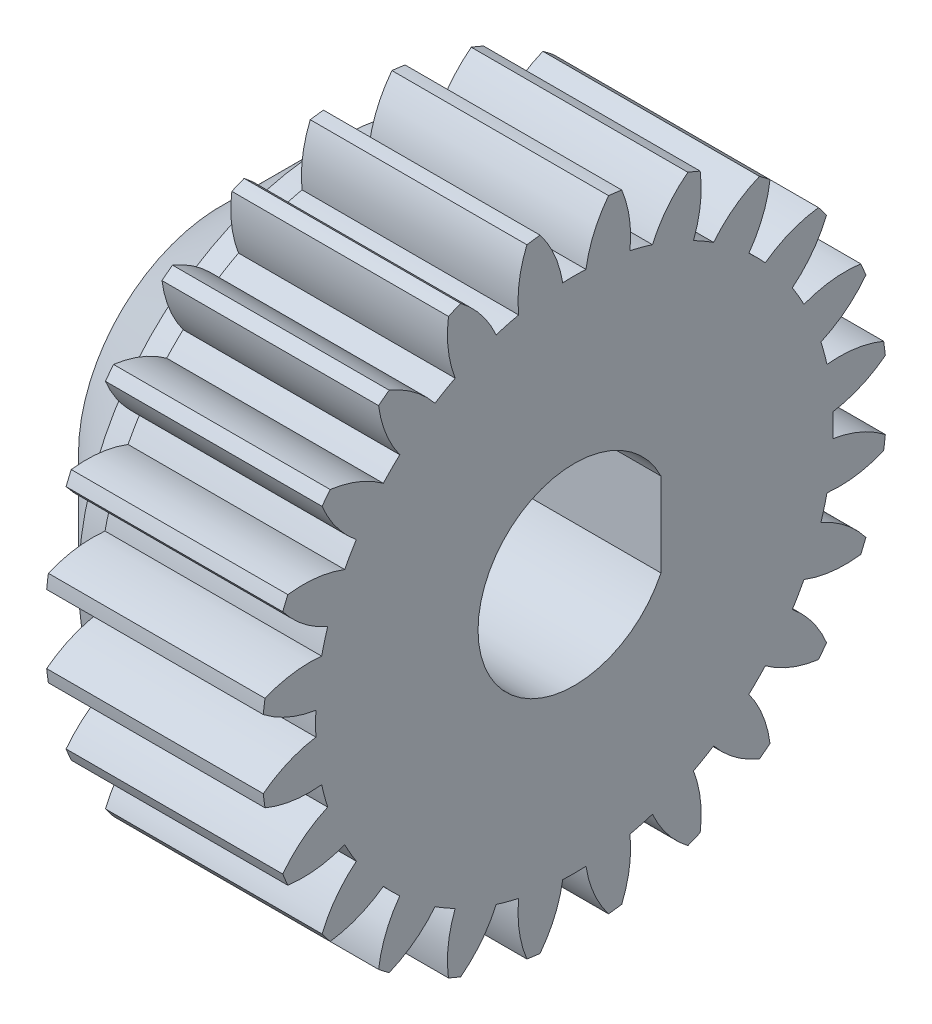
from build123d import *

# Parameters (mm, degrees)
SKETCH_1_W           = 4.5
SKETCH_1_H           = 6.5
CUT_EXTRUDE_1_DEPTH  = 11.234744745
CUT_EXTRUDE_2_DEPTH  = 11.234744745
CUT_EXTRUDE_3_DEPTH  = 11.234744745
CUT_EXTRUDE_4_DEPTH  = 11.234744745
CUT_EXTRUDE_5_DEPTH  = 11.234744745
CUT_EXTRUDE_6_DEPTH  = 11.234744745
CUT_EXTRUDE_7_DEPTH  = 11.234744745
CUT_EXTRUDE_8_DEPTH  = 11.234744745
CUT_EXTRUDE_9_DEPTH  = 11.234744745
CUT_EXTRUDE_10_DEPTH = 11.234744745
CUT_EXTRUDE_11_DEPTH = 11.234744745
CUT_EXTRUDE_12_DEPTH = 11.234744745
CUT_EXTRUDE_13_DEPTH = 11.234744745
CUT_EXTRUDE_14_DEPTH = 11.234744745
CUT_EXTRUDE_15_DEPTH = 11.234744745
CUT_EXTRUDE_16_DEPTH = 11.234744745
CUT_EXTRUDE_17_DEPTH = 11.234744745
CUT_EXTRUDE_18_DEPTH = 11.234744745
CUT_EXTRUDE_19_DEPTH = 11.209995045
CUT_EXTRUDE_20_DEPTH = 11.209995045
CUT_EXTRUDE_21_DEPTH = 11.209995045
CUT_EXTRUDE_22_DEPTH = 11.209995045
CUT_EXTRUDE_23_DEPTH = 11.209995045
CUT_EXTRUDE_24_DEPTH = 11.209995045
SKETCH_28_R          = 5.3
EXTRUDE_2_DEPTH      = 0.5
SKETCH_26_R          = 5.3
EXTRUDE_1_DEPTH      = 2.33
EXTRUDE_1_TAPER      = 45
CUT_EXTRUDE_25_DEPTH = 12.713961717


with BuildPart() as part:
    # 草图1 → 旋转1 (revolve)
    with BuildSketch(Plane(origin=(0, 0, 0), x_dir=(-1, 0, 0), z_dir=(0, 0, -1)), mode=Mode.PRIVATE) as revolve_1_sk:
        with Locations((-2.25, 3.25)):
            Rectangle(SKETCH_1_W, SKETCH_1_H)
    revolve(revolve_1_sk.sketch.rotate(Axis((4.5, 0, 0), (-1, 0, 0)), 270), axis=Axis((4.5, 0, 0), (-1, 0, 0)))

    # 草图2 → 切除-拉伸1 (cut, through all)
    with BuildSketch(Plane(origin=(4.5, 0, 0), x_dir=(0, 0, -1), z_dir=(1, 0, 0))):
        with BuildLine():
            ThreePointArc((-6.056700011, 2.359318752), (-6.278517871, 1.682323793), (-6.424915449, 0.98512003))
            ThreePointArc((-6.424915449, 0.98512003), (-5.84730165, 1.144628565), (-5.248177569, 1.156074481))
            ThreePointArc((-5.248177569, 1.156074481), (-5.19088539, 1.390893548), (-5.123092339, 1.622898915))
            ThreePointArc((-5.123092339, 1.622898915), (-5.636226055, 1.93237341), (-6.056700011, 2.359318752))
        make_face()
    extrude(amount=-CUT_EXTRUDE_1_DEPTH, mode=Mode.SUBTRACT)

    # 草图3 → 切除-拉伸2 (cut, through all)
    with BuildSketch(Plane(origin=(4.5, 0, 0), x_dir=(0, 0, -1), z_dir=(1, 0, 0))):
        with BuildLine():
            ThreePointArc((-5.239686336, 3.846516229), (-5.629165125, 3.25), (-5.951023938, 2.614443361))
            ThreePointArc((-5.951023938, 2.614443361), (-5.351808006, 2.619019322), (-4.770136161, 2.475010506))
            ThreePointArc((-4.770136161, 2.475010506), (-4.65402052, 2.687), (-4.528490053, 2.893553842))
            ThreePointArc((-4.528490053, 2.893553842), (-4.944041268, 3.325292028), (-5.239686336, 3.846516229))
        make_face()
    extrude(amount=-CUT_EXTRUDE_2_DEPTH, mode=Mode.SUBTRACT)

    # 草图4 → 切除-拉伸3 (cut, through all)
    with BuildSketch(Plane(origin=(4.5, 0, 0), x_dir=(0, 0, -1), z_dir=(1, 0, 0))):
        with BuildLine():
            ThreePointArc((-4.065596697, 5.071579981), (-4.596194078, 4.596194078), (-5.071579981, 4.065596697))
            ThreePointArc((-5.071579981, 4.065596697), (-4.49159749, 3.91492824), (-3.967017857, 3.625278654))
            ThreePointArc((-3.967017857, 3.625278654), (-3.799991842, 3.799991842), (-3.625278654, 3.967017857))
            ThreePointArc((-3.625278654, 3.967017857), (-3.91492824, 4.49159749), (-4.065596697, 5.071579981))
        make_face()
    extrude(amount=-CUT_EXTRUDE_3_DEPTH, mode=Mode.SUBTRACT)

    # 草图5 → 切除-拉伸4 (cut, through all)
    with BuildSketch(Plane(origin=(4.5, 0, 0), x_dir=(0, 0, -1), z_dir=(1, 0, 0))):
        with BuildLine():
            ThreePointArc((-3.846516229, 5.239686336), (-3.325292028, 4.944041268), (-2.893553842, 4.528490053))
            ThreePointArc((-2.893553842, 4.528490053), (-2.687, 4.65402052), (-2.475010506, 4.770136161))
            ThreePointArc((-2.475010506, 4.770136161), (-2.619019322, 5.351808006), (-2.614443361, 5.951023938))
            ThreePointArc((-2.614443361, 5.951023938), (-3.25, 5.629165125), (-3.846516229, 5.239686336))
        make_face()
    extrude(amount=-CUT_EXTRUDE_4_DEPTH, mode=Mode.SUBTRACT)

    # 草图6 → 切除-拉伸5 (cut, through all)
    with BuildSketch(Plane(origin=(4.5, 0, 0), x_dir=(0, 0, -1), z_dir=(1, 0, 0))):
        with BuildLine():
            ThreePointArc((-2.359318752, 6.056700011), (-1.93237341, 5.636226055), (-1.622898915, 5.123092339))
            ThreePointArc((-1.622898915, 5.123092339), (-1.390893548, 5.19088539), (-1.156074481, 5.248177569))
            ThreePointArc((-1.156074481, 5.248177569), (-1.144628565, 5.84730165), (-0.98512003, 6.424915449))
            ThreePointArc((-0.98512003, 6.424915449), (-1.682323793, 6.278517871), (-2.359318752, 6.056700011))
        make_face()
    extrude(amount=-CUT_EXTRUDE_5_DEPTH, mode=Mode.SUBTRACT)

    # 草图7 → 切除-拉伸6 (cut, through all)
    with BuildSketch(Plane(origin=(4.5, 0, 0), x_dir=(0, 0, -1), z_dir=(1, 0, 0))):
        with BuildLine():
            ThreePointArc((0.711337602, 6.460959589), (0, 6.5), (-0.711337602, 6.460959589))
            ThreePointArc((-0.711337602, 6.460959589), (-0.407766737, 5.94431135), (-0.241646108, 5.368564348))
            ThreePointArc((-0.241646108, 5.368564348), (0, 5.374), (0.241646108, 5.368564348))
            ThreePointArc((0.241646108, 5.368564348), (0.407766737, 5.94431135), (0.711337602, 6.460959589))
        make_face()
    extrude(amount=-CUT_EXTRUDE_6_DEPTH, mode=Mode.SUBTRACT)

    # 草图8 → 切除-拉伸7 (cut, through all)
    with BuildSketch(Plane(origin=(4.5, 0, 0), x_dir=(0, 0, -1), z_dir=(1, 0, 0))):
        with BuildLine():
            ThreePointArc((2.359318752, 6.056700011), (1.682323793, 6.278517871), (0.98512003, 6.424915449))
            ThreePointArc((0.98512003, 6.424915449), (1.144628565, 5.84730165), (1.156074481, 5.248177569))
            ThreePointArc((1.156074481, 5.248177569), (1.390893548, 5.19088539), (1.622898915, 5.123092339))
            ThreePointArc((1.622898915, 5.123092339), (1.93237341, 5.636226055), (2.359318752, 6.056700011))
        make_face()
    extrude(amount=-CUT_EXTRUDE_7_DEPTH, mode=Mode.SUBTRACT)

    # 草图9 → 切除-拉伸8 (cut, through all)
    with BuildSketch(Plane(origin=(4.5, 0, 0), x_dir=(0, 0, -1), z_dir=(1, 0, 0))):
        with BuildLine():
            ThreePointArc((3.846516229, 5.239686336), (3.25, 5.629165125), (2.614443361, 5.951023938))
            ThreePointArc((2.614443361, 5.951023938), (2.619019322, 5.351808006), (2.475010506, 4.770136161))
            ThreePointArc((2.475010506, 4.770136161), (2.687, 4.65402052), (2.893553842, 4.528490053))
            ThreePointArc((2.893553842, 4.528490053), (3.325292028, 4.944041268), (3.846516229, 5.239686336))
        make_face()
    extrude(amount=-CUT_EXTRUDE_8_DEPTH, mode=Mode.SUBTRACT)

    # 草图10 → 切除-拉伸9 (cut, through all)
    with BuildSketch(Plane(origin=(4.5, 0, 0), x_dir=(0, 0, -1), z_dir=(1, 0, 0))):
        with BuildLine():
            ThreePointArc((5.071579981, 4.065596697), (4.596194078, 4.596194078), (4.065596697, 5.071579981))
            ThreePointArc((4.065596697, 5.071579981), (3.91492824, 4.49159749), (3.625278654, 3.967017857))
            ThreePointArc((3.625278654, 3.967017857), (3.799991842, 3.799991842), (3.967017857, 3.625278654))
            ThreePointArc((3.967017857, 3.625278654), (4.49159749, 3.91492824), (5.071579981, 4.065596697))
        make_face()
    extrude(amount=-CUT_EXTRUDE_9_DEPTH, mode=Mode.SUBTRACT)

    # 草图11 → 切除-拉伸10 (cut, through all)
    with BuildSketch(Plane(origin=(4.5, 0, 0), x_dir=(0, 0, -1), z_dir=(1, 0, 0))):
        with BuildLine():
            ThreePointArc((5.951023938, 2.614443361), (5.629165125, 3.25), (5.239686336, 3.846516229))
            ThreePointArc((5.239686336, 3.846516229), (4.944041268, 3.325292028), (4.528490053, 2.893553842))
            ThreePointArc((4.528490053, 2.893553842), (4.65402052, 2.687), (4.770136161, 2.475010506))
            ThreePointArc((4.770136161, 2.475010506), (5.351808006, 2.619019322), (5.951023938, 2.614443361))
        make_face()
    extrude(amount=-CUT_EXTRUDE_10_DEPTH, mode=Mode.SUBTRACT)

    # 草图12 → 切除-拉伸11 (cut, through all)
    with BuildSketch(Plane(origin=(4.5, 0, 0), x_dir=(0, 0, -1), z_dir=(1, 0, 0))):
        with BuildLine():
            ThreePointArc((6.424915449, 0.98512003), (6.278517871, 1.682323793), (6.056700011, 2.359318752))
            ThreePointArc((6.056700011, 2.359318752), (5.636226055, 1.93237341), (5.123092339, 1.622898915))
            ThreePointArc((5.123092339, 1.622898915), (5.19088539, 1.390893548), (5.248177569, 1.156074481))
            ThreePointArc((5.248177569, 1.156074481), (5.84730165, 1.144628565), (6.424915449, 0.98512003))
        make_face()
    extrude(amount=-CUT_EXTRUDE_11_DEPTH, mode=Mode.SUBTRACT)

    # 草图13 → 切除-拉伸12 (cut, through all)
    with BuildSketch(Plane(origin=(4.5, 0, 0), x_dir=(0, 0, -1), z_dir=(1, 0, 0))):
        with BuildLine():
            ThreePointArc((6.460959589, -0.711337602), (6.5, 0), (6.460959589, 0.711337602))
            ThreePointArc((6.460959589, 0.711337602), (5.94431135, 0.407766737), (5.368564348, 0.241646108))
            ThreePointArc((5.368564348, 0.241646108), (5.374, 0), (5.368564348, -0.241646108))
            ThreePointArc((5.368564348, -0.241646108), (5.94431135, -0.407766737), (6.460959589, -0.711337602))
        make_face()
    extrude(amount=-CUT_EXTRUDE_12_DEPTH, mode=Mode.SUBTRACT)

    # 草图14 → 切除-拉伸13 (cut, through all)
    with BuildSketch(Plane(origin=(4.5, 0, 0), x_dir=(0, 0, -1), z_dir=(1, 0, 0))):
        with BuildLine():
            ThreePointArc((6.056700011, -2.359318752), (6.278517871, -1.682323793), (6.424915449, -0.98512003))
            ThreePointArc((6.424915449, -0.98512003), (5.84730165, -1.144628565), (5.248177569, -1.156074481))
            ThreePointArc((5.248177569, -1.156074481), (5.19088539, -1.390893548), (5.123092339, -1.622898915))
            ThreePointArc((5.123092339, -1.622898915), (5.636226055, -1.93237341), (6.056700011, -2.359318752))
        make_face()
    extrude(amount=-CUT_EXTRUDE_13_DEPTH, mode=Mode.SUBTRACT)

    # 草图15 → 切除-拉伸14 (cut, through all)
    with BuildSketch(Plane(origin=(4.5, 0, 0), x_dir=(0, 0, -1), z_dir=(1, 0, 0))):
        with BuildLine():
            ThreePointArc((5.239686336, -3.846516229), (5.629165125, -3.25), (5.951023938, -2.614443361))
            ThreePointArc((5.951023938, -2.614443361), (5.351808006, -2.619019322), (4.770136161, -2.475010506))
            ThreePointArc((4.770136161, -2.475010506), (4.65402052, -2.687), (4.528490053, -2.893553842))
            ThreePointArc((4.528490053, -2.893553842), (4.944041268, -3.325292028), (5.239686336, -3.846516229))
        make_face()
    extrude(amount=-CUT_EXTRUDE_14_DEPTH, mode=Mode.SUBTRACT)

    # 草图16 → 切除-拉伸15 (cut, through all)
    with BuildSketch(Plane(origin=(4.5, 0, 0), x_dir=(0, 0, -1), z_dir=(1, 0, 0))):
        with BuildLine():
            ThreePointArc((4.065596697, -5.071579981), (4.596194078, -4.596194078), (5.071579981, -4.065596697))
            ThreePointArc((5.071579981, -4.065596697), (4.49159749, -3.91492824), (3.967017857, -3.625278654))
            ThreePointArc((3.967017857, -3.625278654), (3.799991842, -3.799991842), (3.625278654, -3.967017857))
            ThreePointArc((3.625278654, -3.967017857), (3.91492824, -4.49159749), (4.065596697, -5.071579981))
        make_face()
    extrude(amount=-CUT_EXTRUDE_15_DEPTH, mode=Mode.SUBTRACT)

    # 草图17 → 切除-拉伸16 (cut, through all)
    with BuildSketch(Plane(origin=(4.5, 0, 0), x_dir=(0, 0, -1), z_dir=(1, 0, 0))):
        with BuildLine():
            ThreePointArc((2.614443361, -5.951023938), (3.25, -5.629165125), (3.846516229, -5.239686336))
            ThreePointArc((3.846516229, -5.239686336), (3.325292028, -4.944041268), (2.893553842, -4.528490053))
            ThreePointArc((2.893553842, -4.528490053), (2.687, -4.65402052), (2.475010506, -4.770136161))
            ThreePointArc((2.475010506, -4.770136161), (2.619019322, -5.351808006), (2.614443361, -5.951023938))
        make_face()
    extrude(amount=-CUT_EXTRUDE_16_DEPTH, mode=Mode.SUBTRACT)

    # 草图18 → 切除-拉伸17 (cut, through all)
    with BuildSketch(Plane(origin=(4.5, 0, 0), x_dir=(0, 0, -1), z_dir=(1, 0, 0))):
        with BuildLine():
            ThreePointArc((0.98512003, -6.424915449), (1.682323793, -6.278517871), (2.359318752, -6.056700011))
            ThreePointArc((2.359318752, -6.056700011), (1.93237341, -5.636226055), (1.622898915, -5.123092339))
            ThreePointArc((1.622898915, -5.123092339), (1.390893548, -5.19088539), (1.156074481, -5.248177569))
            ThreePointArc((1.156074481, -5.248177569), (1.144628565, -5.84730165), (0.98512003, -6.424915449))
        make_face()
    extrude(amount=-CUT_EXTRUDE_17_DEPTH, mode=Mode.SUBTRACT)

    # 草图19 → 切除-拉伸18 (cut, through all)
    with BuildSketch(Plane(origin=(4.5, 0, 0), x_dir=(0, 0, -1), z_dir=(1, 0, 0))):
        with BuildLine():
            ThreePointArc((-0.711337602, -6.460959589), (0, -6.5), (0.711337602, -6.460959589))
            ThreePointArc((0.711337602, -6.460959589), (0.407766737, -5.94431135), (0.241646108, -5.368564348))
            ThreePointArc((0.241646108, -5.368564348), (0, -5.374), (-0.241646108, -5.368564348))
            ThreePointArc((-0.241646108, -5.368564348), (-0.407766737, -5.94431135), (-0.711337602, -6.460959589))
        make_face()
    extrude(amount=-CUT_EXTRUDE_18_DEPTH, mode=Mode.SUBTRACT)

    # 草图20 → 切除-拉伸19 (cut, through all)
    with BuildSketch(Plane(origin=(4.5, 0, 0), x_dir=(0, 0, -1), z_dir=(1, 0, 0))):
        with BuildLine():
            ThreePointArc((-2.359318752, -6.056700011), (-1.682323793, -6.278517871), (-0.98512003, -6.424915449))
            ThreePointArc((-0.98512003, -6.424915449), (-1.144628565, -5.84730165), (-1.156074481, -5.248177569))
            ThreePointArc((-1.156074481, -5.248177569), (-1.390893548, -5.19088539), (-1.622898915, -5.123092339))
            ThreePointArc((-1.622898915, -5.123092339), (-1.93237341, -5.636226055), (-2.359318752, -6.056700011))
        make_face()
    extrude(amount=-CUT_EXTRUDE_19_DEPTH, mode=Mode.SUBTRACT)

    # 草图21 → 切除-拉伸20 (cut, through all)
    with BuildSketch(Plane(origin=(4.5, 0, 0), x_dir=(0, 0, -1), z_dir=(1, 0, 0))):
        with BuildLine():
            ThreePointArc((-3.846516229, -5.239686336), (-3.25, -5.629165125), (-2.614443361, -5.951023938))
            ThreePointArc((-2.614443361, -5.951023938), (-2.619019322, -5.351808006), (-2.475010506, -4.770136161))
            ThreePointArc((-2.475010506, -4.770136161), (-2.687, -4.65402052), (-2.893553842, -4.528490053))
            ThreePointArc((-2.893553842, -4.528490053), (-3.325292028, -4.944041268), (-3.846516229, -5.239686336))
        make_face()
    extrude(amount=-CUT_EXTRUDE_20_DEPTH, mode=Mode.SUBTRACT)

    # 草图22 → 切除-拉伸21 (cut, through all)
    with BuildSketch(Plane(origin=(4.5, 0, 0), x_dir=(0, 0, -1), z_dir=(1, 0, 0))):
        with BuildLine():
            ThreePointArc((-5.071579981, -4.065596697), (-4.596194078, -4.596194078), (-4.065596697, -5.071579981))
            ThreePointArc((-4.065596697, -5.071579981), (-3.91492824, -4.49159749), (-3.625278654, -3.967017857))
            ThreePointArc((-3.625278654, -3.967017857), (-3.799991842, -3.799991842), (-3.967017857, -3.625278654))
            ThreePointArc((-3.967017857, -3.625278654), (-4.49159749, -3.91492824), (-5.071579981, -4.065596697))
        make_face()
    extrude(amount=-CUT_EXTRUDE_21_DEPTH, mode=Mode.SUBTRACT)

    # 草图23 → 切除-拉伸22 (cut, through all)
    with BuildSketch(Plane(origin=(4.5, 0, 0), x_dir=(0, 0, -1), z_dir=(1, 0, 0))):
        with BuildLine():
            ThreePointArc((-5.951023938, -2.614443361), (-5.629165125, -3.25), (-5.239686336, -3.846516229))
            ThreePointArc((-5.239686336, -3.846516229), (-4.944041268, -3.325292028), (-4.528490053, -2.893553842))
            ThreePointArc((-4.528490053, -2.893553842), (-4.65402052, -2.687), (-4.770136161, -2.475010506))
            ThreePointArc((-4.770136161, -2.475010506), (-5.351808006, -2.619019322), (-5.951023938, -2.614443361))
        make_face()
    extrude(amount=-CUT_EXTRUDE_22_DEPTH, mode=Mode.SUBTRACT)

    # 草图24 → 切除-拉伸23 (cut, through all)
    with BuildSketch(Plane(origin=(4.5, 0, 0), x_dir=(0, 0, -1), z_dir=(1, 0, 0))):
        with BuildLine():
            ThreePointArc((-6.424915449, -0.98512003), (-6.278517871, -1.682323793), (-6.056700011, -2.359318752))
            ThreePointArc((-6.056700011, -2.359318752), (-5.636226055, -1.93237341), (-5.123092339, -1.622898915))
            ThreePointArc((-5.123092339, -1.622898915), (-5.19088539, -1.390893548), (-5.248177569, -1.156074481))
            ThreePointArc((-5.248177569, -1.156074481), (-5.84730165, -1.144628565), (-6.424915449, -0.98512003))
        make_face()
    extrude(amount=-CUT_EXTRUDE_23_DEPTH, mode=Mode.SUBTRACT)

    # 草图25 → 切除-拉伸24 (cut, through all)
    with BuildSketch(Plane(origin=(4.5, 0, 0), x_dir=(0, 0, -1), z_dir=(1, 0, 0))):
        with BuildLine():
            ThreePointArc((-6.460959589, 0.711337602), (-6.5, 0), (-6.460959589, -0.711337602))
            ThreePointArc((-6.460959589, -0.711337602), (-5.94431135, -0.407766737), (-5.368564348, -0.241646108))
            ThreePointArc((-5.368564348, -0.241646108), (-5.374, 0), (-5.368564348, 0.241646108))
            ThreePointArc((-5.368564348, 0.241646108), (-5.94431135, 0.407766737), (-6.460959589, 0.711337602))
        make_face()
    extrude(amount=-CUT_EXTRUDE_24_DEPTH, mode=Mode.SUBTRACT)

    # 草图28 → 凸台-拉伸2 (add)
    with BuildSketch(Plane.ZY):
        Circle(SKETCH_28_R)
    extrude(amount=EXTRUDE_2_DEPTH)

    # 草图26 → 凸台-拉伸1 (add)
    with BuildSketch(Plane.ZY.offset(0.5)):
        Circle(SKETCH_26_R)
    extrude(amount=EXTRUDE_1_DEPTH, taper=EXTRUDE_1_TAPER)

    # 草图27 → 切除-拉伸25 (cut, through all)
    with BuildSketch(Plane(origin=(4.5, 0, 0), x_dir=(0, 0, -1), z_dir=(1, 0, 0))):
        with BuildLine():
            Line((1.8, -0.871779789), (1.8, 0.871779789))
            ThreePointArc((1.8, 0.871779789), (-2, 0), (1.8, -0.871779789))
        make_face()
    extrude(amount=-CUT_EXTRUDE_25_DEPTH, mode=Mode.SUBTRACT)


solid = part.part
